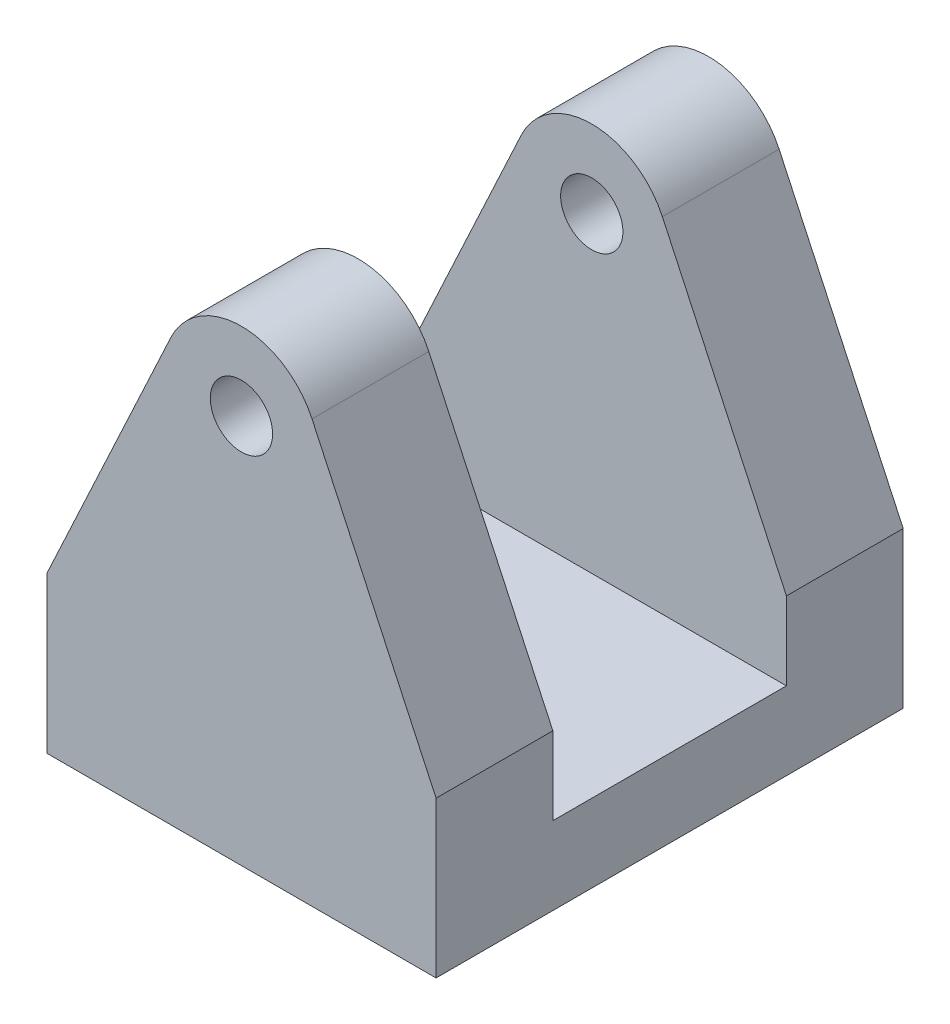
from build123d import *

# Parameters (mm, degrees)
BOSS_EXTRUDE2_DEPTH = 19.05
SKETCH3_R           = 5.08
CUT_EXTRUDE1_DEPTH  = 19.05
SKETCH5_W           = 63.503429877
SKETCH5_H           = 12.7
BOSS_EXTRUDE3_DEPTH = 19.05


with BuildPart() as part:
    # Sketch2 → Boss-Extrude2 (new body)
    with BuildSketch(Plane.XY):
        with BuildLine():
            Line((2.477787128, -10.031332986), (2.477787128, 15.370038965))
            Line((2.477787128, 15.370038965), (22.715808333, 58.833279677))
            ThreePointArc((22.715808333, 58.833279677), (34.229502066, 66.172782867), (45.7431958, 58.833279677))
            Line((45.7431958, 58.833279677), (65.981217005, 15.370038965))
            Line((65.981217005, 15.370038965), (65.981217005, -10.031332986))
            Line((65.981217005, -10.031332986), (2.477787128, -10.031332986))
        make_face()
    boss_extrude2 = extrude(amount=BOSS_EXTRUDE2_DEPTH)

    # Sketch3 → Cut-Extrude1 (cut)
    with BuildSketch(Plane.XY.offset(19.05)):
        with Locations((34.229502066, 53.472096891)):
            Circle(SKETCH3_R)
    cut_extrude1 = extrude(amount=-CUT_EXTRUDE1_DEPTH, mode=Mode.SUBTRACT)

    # Sketch5 → Boss-Extrude3 (add)
    with BuildSketch(Plane(origin=(0, 0, 0), x_dir=(-1, 0, 0), z_dir=(0, 0, -1))):
        with Locations((-34.229502067, -3.681332986)):
            Rectangle(SKETCH5_W, SKETCH5_H)
    boss_extrude3 = extrude(amount=BOSS_EXTRUDE3_DEPTH)

    # Mirror1: Boss-Extrude2, Cut-Extrude1, Boss-Extrude3 across plane
    add(boss_extrude2.mirror(Plane.XY.offset(-19.05)))
    add(cut_extrude1.mirror(Plane.XY.offset(-19.05)), mode=Mode.SUBTRACT)
    add(boss_extrude3.mirror(Plane.XY.offset(-19.05)))


solid = part.part
